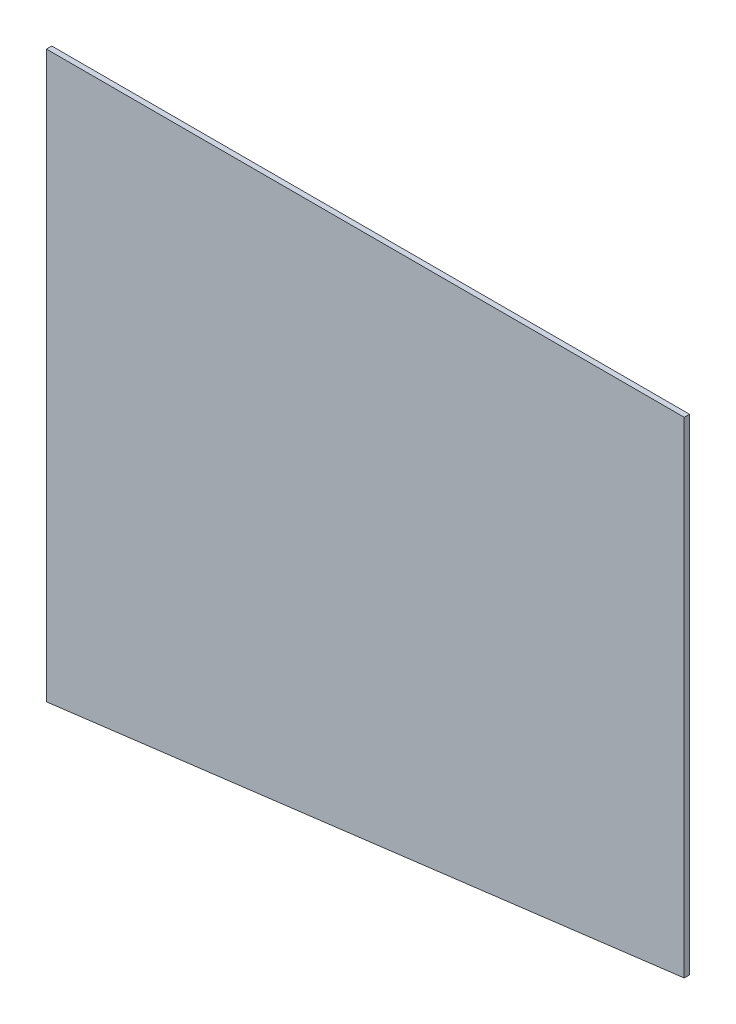
from build123d import *

# Parameters (mm, degrees)
BOSS_EXTRUDE1_DEPTH = 2


with BuildPart() as part:
    # Sketch1 → Boss-Extrude1 (new body)
    with BuildSketch(Plane.XY):
        Polygon((172.285714286, -133.234435563), (172.285714286, 49.491616474), (-67.714285714, 49.491616474), (-67.714285714, -163.234435563), align=None)
    extrude(amount=BOSS_EXTRUDE1_DEPTH)


solid = part.part
